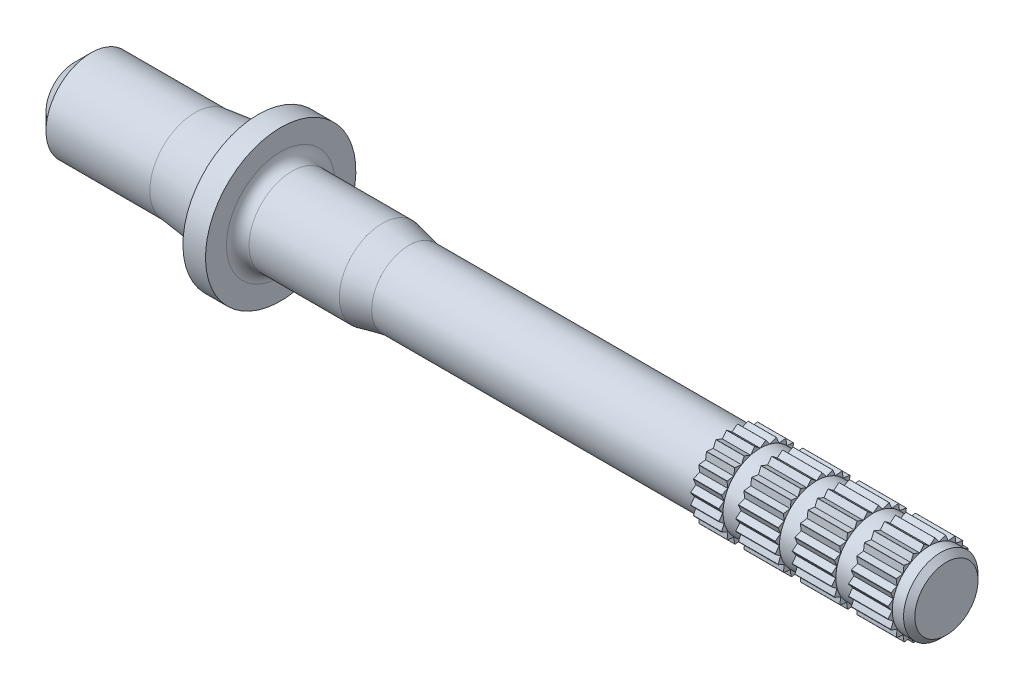
from build123d import *

# Parameters (mm, degrees)
CUT_EXTRUDE1_REACH = 40.939
CIRPATTERN1_COUNT  = 24
SKETCH5_OUTSIDE_W  = 16.618
SKETCH5_OUTSIDE_H  = 16.618
SKETCH5_OUTSIDE_R  = 1.65
CUT_EXTRUDE4_DEPTH = 0.75
LPATTERN1_COUNT    = 4
LPATTERN1_PITCH    = 2.5
CHAMFER1_SIZE      = 0.25
CHAMFER2_SIZE      = 0.75
FILLET1_R          = 0.5


with BuildPart() as part:
    # Sketch1 → Revolve1 (revolve)
    with BuildSketch(Plane.XY):
        Polygon((0, 0), (0, 2), (5.35, 2), (8.15, 2.331401839), (8.15, 3.331401839), (9.15, 3.331401839), (9.15, 1.901401839), (13.65, 1.901401839), (14.832752661, 1.65), (29.152752661, 1.65), (29.152752661, 1.85), (38.652752661, 1.85), (38.652752661, 0), align=None)
    revolve(axis=Axis((38.652752661, 0, 0), (-1, 0, 0)))

    # Sketch2 → Cut-Extrude1 (cut, up to next)
    with BuildSketch(Plane(origin=(38.652752661, 0, 0), x_dir=(0, 0, -1), z_dir=(1, 0, 0)), mode=Mode.PRIVATE) as cut_extrude1_sk1:
        with BuildLine():
            Line((-0.240231454, 1.834336078), (0, 1.65))
            Line((0, 1.65), (0.240231454, 1.834336078))
            ThreePointArc((0.240231454, 1.834336078), (0, 1.85), (-0.240231454, 1.834336078))
        make_face()
    cut_extrude1_tool1 = extrude(cut_extrude1_sk1.sketch, amount=-CUT_EXTRUDE1_REACH, mode=Mode.PRIVATE) & part.part
    cut_extrude1 = cut_extrude1_tool1.solids().sort_by_distance((38.652753, 1.779787, 0))[0]
    add(cut_extrude1, mode=Mode.SUBTRACT)

    # CirPattern1: Cut-Extrude1 ×24 about axis
    cirpattern1_axis = Axis((0, -0.008198996, 0), (1, 0, 0))
    for i in range(1, CIRPATTERN1_COUNT):
        add(cut_extrude1.rotate(cirpattern1_axis, i * 360 / CIRPATTERN1_COUNT), mode=Mode.SUBTRACT)

    # Sketch5 outside → Cut-Extrude4 (cut)
    with BuildSketch(Plane(origin=(38.652752661, 0, 0), x_dir=(0, 0, -1), z_dir=(1, 0, 0))):
        Rectangle(SKETCH5_OUTSIDE_W, SKETCH5_OUTSIDE_H)
        with Locations(Location((0, 0, 0), (0, 0, 90))):
            Circle(SKETCH5_OUTSIDE_R, mode=Mode.SUBTRACT)
    cut_extrude4 = extrude(amount=-CUT_EXTRUDE4_DEPTH, mode=Mode.SUBTRACT)

    # LPattern1: Cut-Extrude4 ×4
    with Locations(*[(-i * LPATTERN1_PITCH, 0, 0) for i in range(1, LPATTERN1_COUNT)]):
        add(cut_extrude4, mode=Mode.SUBTRACT)

    # Chamfer1
    chamfer1_edges = [part.edges().sort_by_distance(p)[0] for p in [
        (38.652752661, -1.65, 0),
    ]]
    chamfer(chamfer1_edges, length=CHAMFER1_SIZE)

    # Chamfer2
    chamfer2_edges = [part.edges().sort_by_distance(p)[0] for p in [
        (0, -2, 0),
    ]]
    chamfer(chamfer2_edges, length=CHAMFER2_SIZE)

    # Fillet1
    fillet1_edges = [part.edges().sort_by_distance(p)[0] for p in [
        (9.15, -1.901401839, 0),
        (8.15, -2.331401839, 0),
    ]]
    fillet(fillet1_edges, radius=FILLET1_R)


solid = part.part
